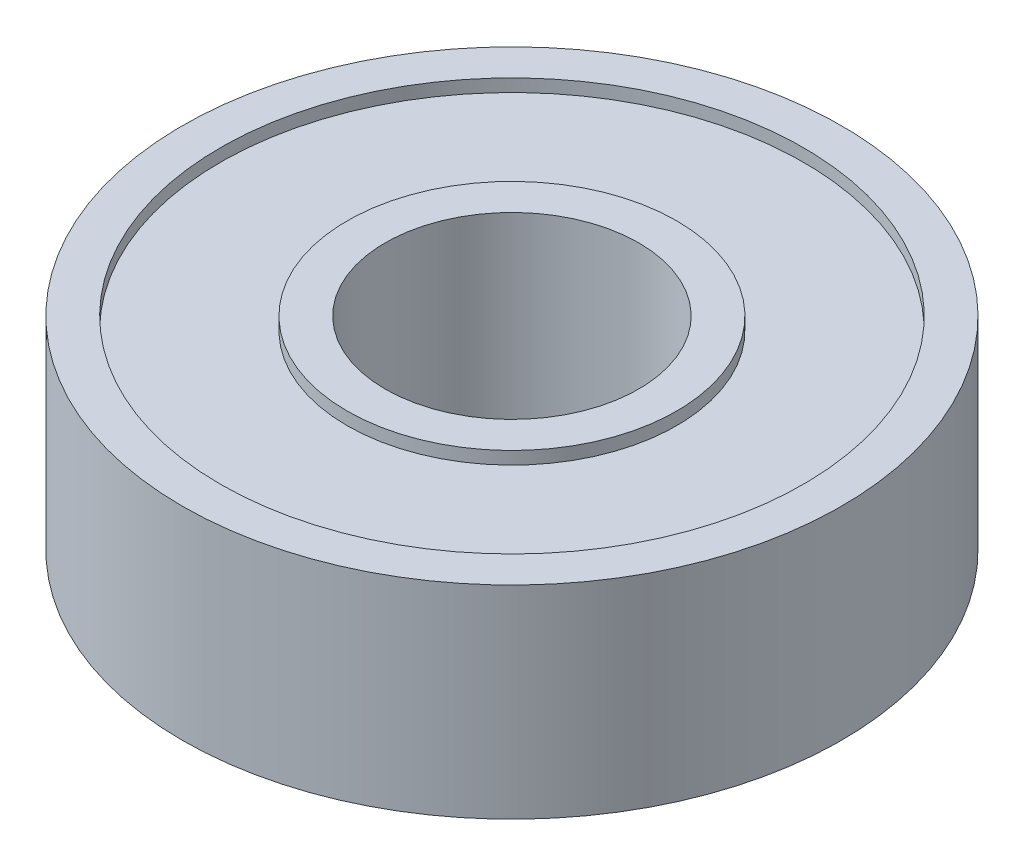
from build123d import *

# Parameters (mm, degrees)
ESBO_O1_W = 1.5
ESBO_O1_H = 8
ESBO_O4_W = 5
ESBO_O4_H = 7


with BuildPart() as part:
    # Esboço1 → Revolução1 (revolve)
    with BuildSketch(Plane.XY, mode=Mode.PRIVATE) as revolu_o1_sk:
        with Locations((5.75, 0)):
            Rectangle(ESBO_O1_W, ESBO_O1_H)
        with Locations((12.25, 0)):
            Rectangle(ESBO_O1_W, ESBO_O1_H)
    revolve(revolu_o1_sk.sketch.rotate(Axis((0, 7.601094967, 0), (0, -1, 0)), 90), axis=Axis((0, 7.601094967, 0), (0, -1, 0)))

    # Esboço4 → Revolução2 (revolve)
    with BuildSketch(Plane.XY, mode=Mode.PRIVATE) as revolu_o2_sk:
        with Locations((-9, 0)):
            Rectangle(ESBO_O4_W, ESBO_O4_H)
    revolve(revolu_o2_sk.sketch.rotate(Axis((0, 5.982287702, 0), (0, -1, 0)), 270), axis=Axis((0, 5.982287702, 0), (0, -1, 0)))


solid = part.part
